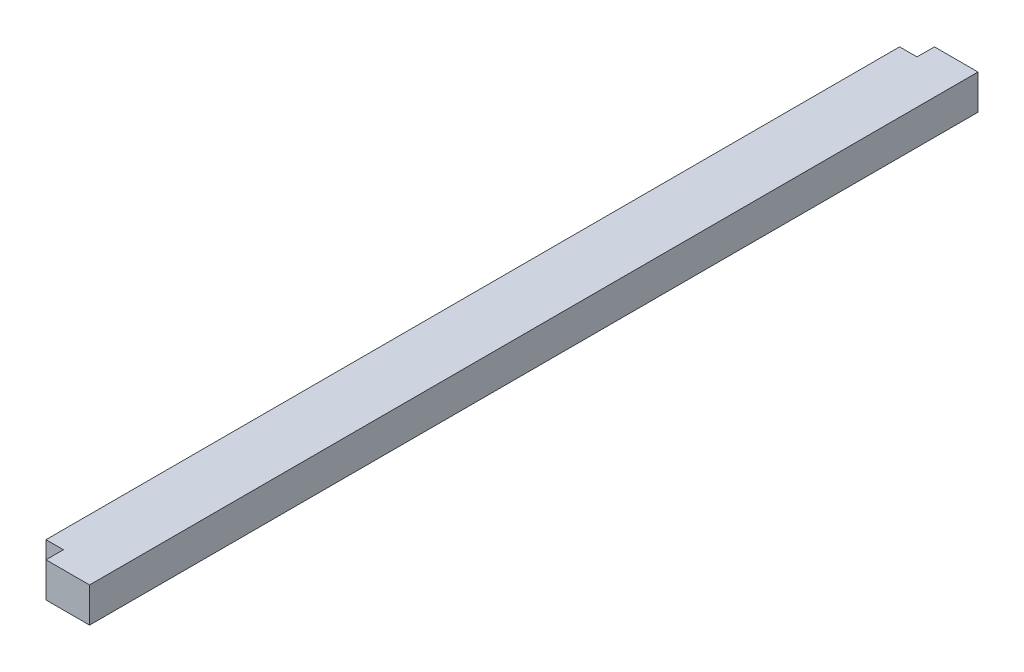
from build123d import *

# Parameters (mm, degrees)
EXTRUDE_1_DEPTH     = 510
SKETCH_2_W          = 10
SKETCH_2_H          = 10
CUT_EXTRUDE_1_DEPTH = 512.590656678


with BuildPart() as part:
    # Эскиз1 → Бобышка-Вытянуть1 (new body)
    with BuildSketch(Plane(origin=(0, 0, 0), x_dir=(1, 0, 0), z_dir=(0, 0, -1))):
        Polygon((0, 10), (10, 10), (10, 20), (35, 20), (35, 0), (0, 0), align=None)
    extrude(amount=EXTRUDE_1_DEPTH)

    # Эскиз2 → Вырез-Вытянуть1 (cut, through all)
    with BuildSketch(Plane(origin=(0, 0, 0), x_dir=(1, 0, 0), z_dir=(0, 1, 0))):
        with Locations((5, 505)):
            Rectangle(SKETCH_2_W, SKETCH_2_H)
        with Locations((5, 5)):
            Rectangle(SKETCH_2_W, SKETCH_2_H)
    extrude(amount=-CUT_EXTRUDE_1_DEPTH, mode=Mode.SUBTRACT)


solid = part.part
